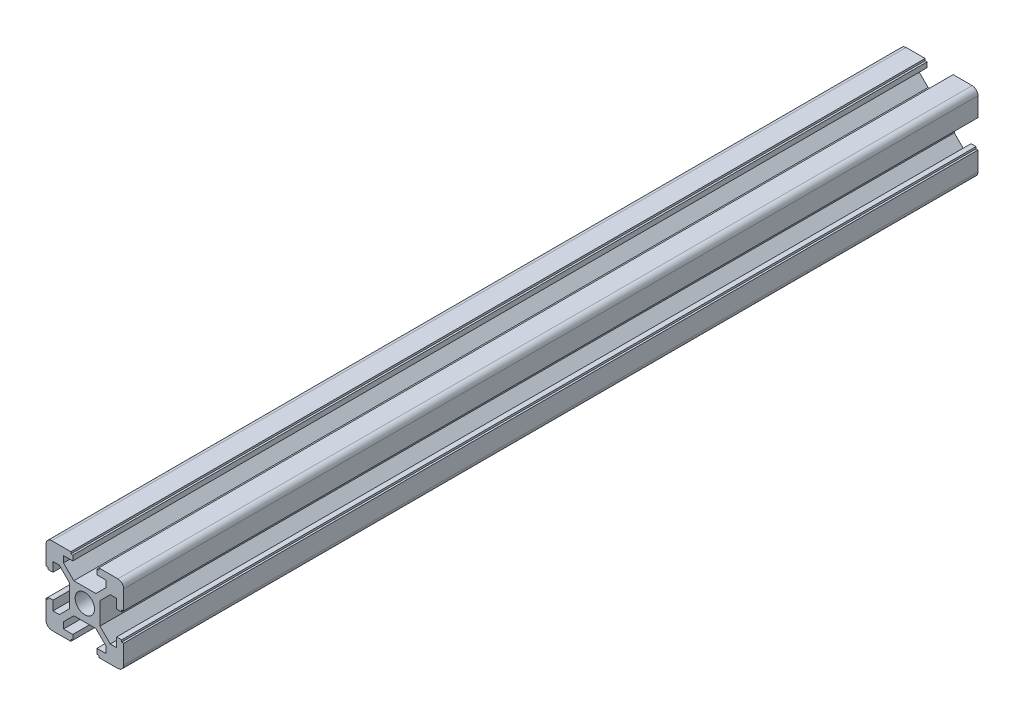
from build123d import *

# Parameters (mm, degrees)
SKETCH1_R           = 2.5
BOSS_EXTRUDE1_DEPTH = 220


with BuildPart() as part:
    # Sketch1 → Boss-Extrude1 (new body)
    with BuildSketch(Plane.XY):
        with BuildLine():
            Line((2.839339828, 3.9), (5.5, 6.560660172))
            Line((5.5, 6.560660172), (5.5, 8.2))
            Line((5.5, 8.2), (3.1, 8.2))
            Line((3.1, 8.2), (3.1, 9.5))
            Line((3.1, 9.5), (3.6, 9.5))
            Line((3.6, 9.5), (3.6, 10))
            Line((3.6, 10), (8.5, 10))
            ThreePointArc((8.5, 10), (9.560660172, 9.560660172), (10, 8.5))
            Line((10, 8.5), (10, 3.6))
            Line((10, 3.6), (9.5, 3.6))
            Line((9.5, 3.6), (9.5, 3.1))
            Line((9.5, 3.1), (8.2, 3.1))
            Line((8.2, 3.1), (8.2, 5.5))
            Line((8.2, 5.5), (6.560660172, 5.5))
            Line((6.560660172, 5.5), (3.9, 2.839339828))
            Line((3.9, 2.839339828), (3.9, -2.839339828))
            Line((3.9, -2.839339828), (6.560660172, -5.5))
            Line((6.560660172, -5.5), (8.2, -5.5))
            Line((8.2, -5.5), (8.2, -3.1))
            Line((8.2, -3.1), (9.5, -3.1))
            Line((9.5, -3.1), (9.5, -3.6))
            Line((9.5, -3.6), (10, -3.6))
            Line((10, -3.6), (10, -8.5))
            ThreePointArc((10, -8.5), (9.560660172, -9.560660172), (8.5, -10))
            Line((8.5, -10), (3.6, -10))
            Line((3.6, -10), (3.6, -9.5))
            Line((3.6, -9.5), (3.1, -9.5))
            Line((3.1, -9.5), (3.1, -8.2))
            Line((3.1, -8.2), (5.5, -8.2))
            Line((5.5, -8.2), (5.5, -6.560660172))
            Line((5.5, -6.560660172), (2.839339828, -3.9))
            Line((2.839339828, -3.9), (-2.839339828, -3.9))
            Line((-2.839339828, -3.9), (-5.5, -6.560660172))
            Line((-5.5, -6.560660172), (-5.5, -8.2))
            Line((-5.5, -8.2), (-3.1, -8.2))
            Line((-3.1, -8.2), (-3.1, -9.5))
            Line((-3.1, -9.5), (-3.6, -9.5))
            Line((-3.6, -9.5), (-3.6, -10))
            Line((-3.6, -10), (-8.5, -10))
            ThreePointArc((-8.5, -10), (-9.560660172, -9.560660172), (-10, -8.5))
            Line((-10, -8.5), (-10, -3.6))
            Line((-10, -3.6), (-9.5, -3.6))
            Line((-9.5, -3.6), (-9.5, -3.1))
            Line((-9.5, -3.1), (-8.2, -3.1))
            Line((-8.2, -3.1), (-8.2, -5.5))
            Line((-8.2, -5.5), (-6.560660172, -5.5))
            Line((-6.560660172, -5.5), (-3.9, -2.839339828))
            Line((-3.9, -2.839339828), (-3.9, 2.839339828))
            Line((-3.9, 2.839339828), (-6.560660172, 5.5))
            Line((-6.560660172, 5.5), (-8.2, 5.5))
            Line((-8.2, 5.5), (-8.2, 3.1))
            Line((-8.2, 3.1), (-9.5, 3.1))
            Line((-9.5, 3.1), (-9.5, 3.6))
            Line((-9.5, 3.6), (-10, 3.6))
            Line((-10, 3.6), (-10, 8.5))
            ThreePointArc((-10, 8.5), (-9.560660172, 9.560660172), (-8.5, 10))
            Line((-8.5, 10), (-3.6, 10))
            Line((-3.6, 10), (-3.6, 9.5))
            Line((-3.6, 9.5), (-3.1, 9.5))
            Line((-3.1, 9.5), (-3.1, 8.2))
            Line((-3.1, 8.2), (-5.5, 8.2))
            Line((-5.5, 8.2), (-5.5, 6.560660172))
            Line((-5.5, 6.560660172), (-2.839339828, 3.9))
            Line((-2.839339828, 3.9), (2.839339828, 3.9))
        make_face()
        with Locations((0, 0.235847297)):
            Circle(SKETCH1_R, mode=Mode.SUBTRACT)
    extrude(amount=BOSS_EXTRUDE1_DEPTH)


solid = part.part
